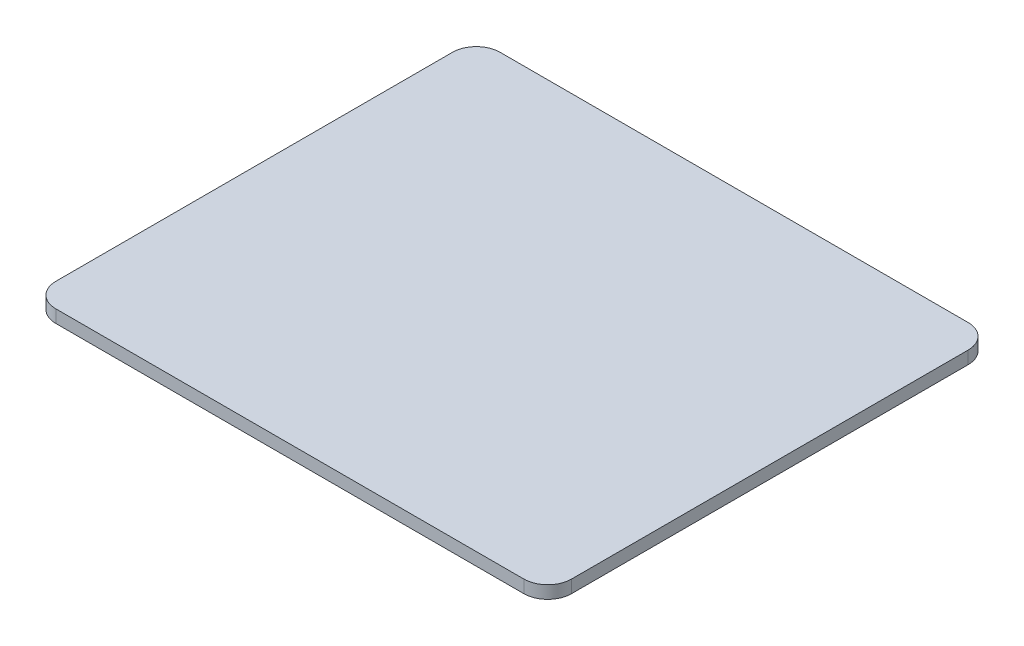
from build123d import *

# Parameters (mm, degrees)
SKETCH2_W           = 65
SKETCH2_H           = 56
BOSS_EXTRUDE1_DEPTH = 1.6
FILLET1_R           = 3


with BuildPart() as part:
    # Sketch2 → Boss-Extrude1 (new body)
    with BuildSketch(Plane(origin=(0, 0, 0), x_dir=(1, 0, 0), z_dir=(0, 1, 0))):
        Rectangle(SKETCH2_W, SKETCH2_H)
    extrude(amount=BOSS_EXTRUDE1_DEPTH)

    # Fillet1
    fillet1_edges = [part.edges().sort_by_distance(p)[0] for p in [
        (-32.5, 0.8, -28),
        (32.5, 0.8, -28),
        (32.5, 0.8, 28),
        (-32.5, 0.8, 28),
    ]]
    fillet(fillet1_edges, radius=FILLET1_R)


solid = part.part
